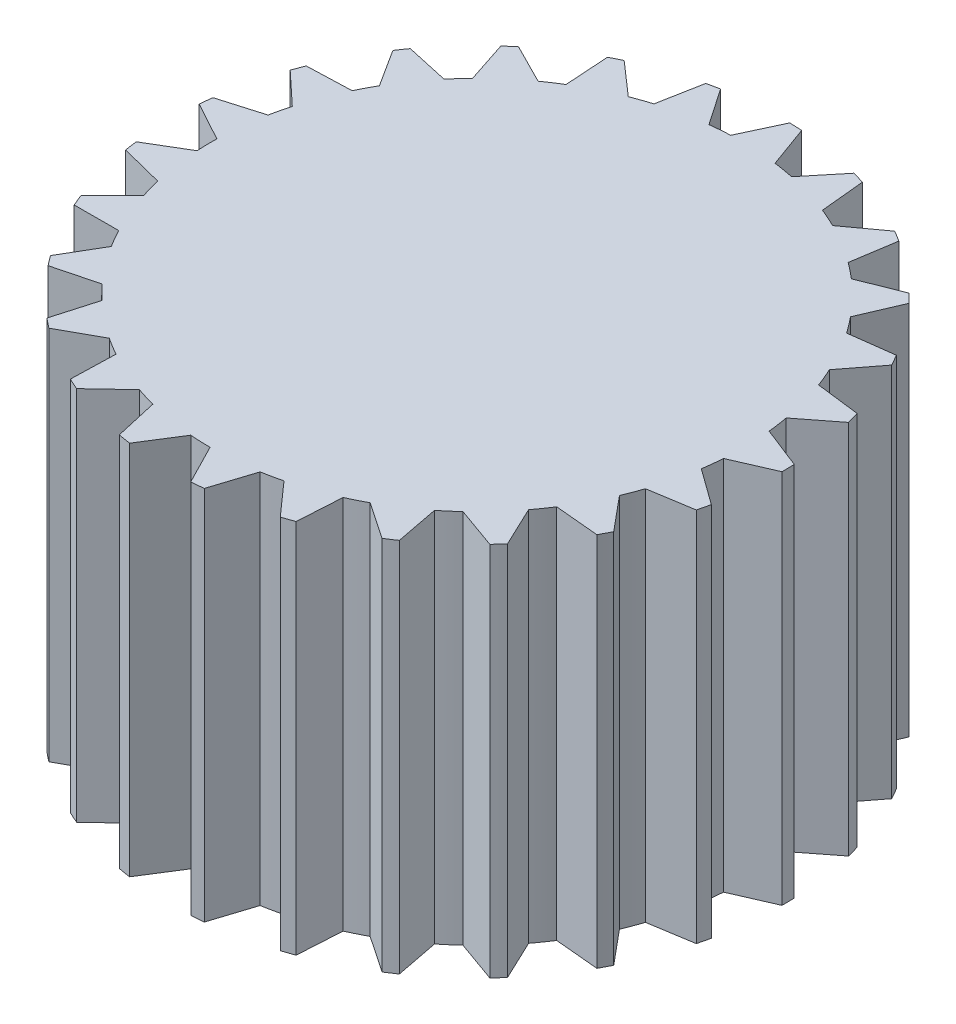
from build123d import *

# Parameters (mm, degrees)
SKETCH1_R           = 2.65
BOSS_EXTRUDE1_DEPTH = 3.75
CUT_EXTRUDE1_DEPTH  = 2.75
BOSS_EXTRUDE2_START = -3.75
BOSS_EXTRUDE2_DEPTH = 3.75


with BuildPart() as part:
    # Sketch1 → Boss-Extrude1 (new body)
    with BuildSketch(Plane(origin=(0, 0, 0), x_dir=(1, 0, 0), z_dir=(0, 1, 0))):
        with Locations(Location((0, 0, 0), (0, 0, 270))):
            Circle(SKETCH1_R)
    extrude(amount=BOSS_EXTRUDE1_DEPTH)

    # Sketch2 → Cut-Extrude1 (cut)
    with BuildSketch(Plane(origin=(0, 0, 0), x_dir=(-1, 0, 0), z_dir=(0, -1, 0))):
        Polygon((-0.749366211, 2.306312052), (-0.348066685, 2.197606558), (0, 2.425), (0.348066685, 2.197606558), (0.749366211, 2.306312052), (1.010128862, 1.982489516), (1.425379237, 1.961866211), (1.573312588, 1.573312588), (1.961866211, 1.425379237), (1.982489516, 1.010128862), (2.306312052, 0.749366211), (2.197606558, 0.348066685), (2.425, 0), (2.197606558, -0.348066685), (2.306312052, -0.749366211), (1.982489516, -1.010128862), (1.961866211, -1.425379237), (1.573312588, -1.573312588), (1.425379237, -1.961866211), (1.010128862, -1.982489516), (0.749366211, -2.306312052), (0.348066685, -2.197606558), (0, -2.425), (-0.348066685, -2.197606558), (-0.749366211, -2.306312052), (-1.010128862, -1.982489516), (-1.425379237, -1.961866211), (-1.573312588, -1.573312588), (-1.961866211, -1.425379237), (-1.982489516, -1.010128862), (-2.306312052, -0.749366211), (-2.197606558, -0.348066685), (-2.425, 0), (-2.197606558, 0.348066685), (-2.306312052, 0.749366211), (-1.982489516, 1.010128862), (-1.961866211, 1.425379237), (-1.573312588, 1.573312588), (-1.425379237, 1.961866211), (-1.010128862, 1.982489516), align=None)
    extrude(amount=-CUT_EXTRUDE1_DEPTH, mode=Mode.SUBTRACT)

    # Sketch3 → Boss-Extrude2 (add)
    with BuildSketch(Plane(origin=(0, 3.75, 0), x_dir=(1, 0, 0), z_dir=(0, 1, 0)).offset(BOSS_EXTRUDE2_START)):
        with BuildLine():
            Line((-2.649502742, 0.051334382), (-3.038574166, 0.26375564))
            ThreePointArc((-3.038574166, 0.26375564), (-3.03254237, 0.325863125), (-3.02524125, 0.387834215))
            Line((-3.02524125, 0.387834215), (-2.599921696, 0.512744745))
            ThreePointArc((-2.599921696, 0.512744745), (-2.578570239, 0.611126438), (-2.5534974, 0.708626156))
            Line((-2.5534974, 0.708626156), (-2.877518411, 1.011131938))
            ThreePointArc((-2.877518411, 1.011131938), (-2.856230611, 1.069788155), (-2.833747286, 1.127996595))
            Line((-2.833747286, 1.127996595), (-2.390725942, 1.143210159))
            ThreePointArc((-2.390725942, 1.143210159), (-2.345578748, 1.233191119), (-2.297046425, 1.321392342))
            Line((-2.297046425, 1.321392342), (-2.535657591, 1.694975097))
            ThreePointArc((-2.535657591, 1.694975097), (-2.500451378, 1.746494462), (-2.464198558, 1.7972828))
            Line((-2.464198558, 1.7972828), (-2.031312085, 1.701843475))
            ThreePointArc((-2.031312085, 1.701843475), (-1.965205918, 1.777769866), (-1.896263575, 1.851130588))
            Line((-1.896263575, 1.851130588), (-2.034472079, 2.272316738))
            ThreePointArc((-2.034472079, 2.272316738), (-1.98755959, 2.313462098), (-1.939815172, 2.353639118))
            Line((-1.939815172, 2.353639118), (-1.544263419, 2.153543706))
            ThreePointArc((-1.544263419, 2.153543706), (-1.461351973, 2.210644795), (-1.376331511, 2.264555491))
            Line((-1.376331511, 2.264555491), (-1.405453205, 2.706880361))
            ThreePointArc((-1.405453205, 2.706880361), (-1.349782122, 2.735066402), (-1.293546065, 2.762107633))
            Line((-1.293546065, 2.762107633), (-0.960183003, 2.469928866))
            ThreePointArc((-0.960183003, 2.469928866), (-0.865675909, 2.504616781), (-0.769919476, 2.535690044))
            Line((-0.769919476, 2.535690044), (-0.688124536, 2.971360736))
            ThreePointArc((-0.688124536, 2.971360736), (-0.62719288, 2.984816425), (-0.565998701, 2.997022768))
            Line((-0.565998701, 2.997022768), (-0.315770757, 2.631119311))
            ThreePointArc((-0.315770757, 2.631119311), (-0.215606244, 2.641214483), (-0.115130569, 2.647497866))
            Line((-0.115130569, 2.647497866), (0.072441528, 3.049139588))
            ThreePointArc((0.072441528, 3.049139588), (0.134805198, 3.047019455), (0.197112443, 3.043623939))
            Line((0.197112443, 3.043623939), (0.348482526, 2.626986854))
            ThreePointArc((0.348482526, 2.626986854), (0.448010755, 2.611854966), (0.546892416, 2.592953661))
            Line((0.546892416, 2.592953661), (0.828455824, 2.935329785))
            ThreePointArc((0.828455824, 2.935329785), (0.888332969, 2.917767046), (0.947838287, 2.898983025))
            Line((0.947838287, 2.898983025), (0.990839371, 2.457791151))
            ThreePointArc((0.990839371, 2.457791151), (1.08347759, 2.418382995), (1.174552138, 2.37548464))
            Line((1.174552138, 2.37548464), (1.532415194, 2.637082417))
            ThreePointArc((1.532415194, 2.637082417), (1.586043513, 2.605180603), (1.639007966, 2.572188346))
            Line((1.639007966, 2.572188346), (1.570938134, 2.134163391))
            ThreePointArc((1.570938134, 2.134163391), (1.650865543, 2.072955127), (1.72841043, 2.008755183))
            Line((1.72841043, 2.008755183), (2.140087281, 2.173137462))
            ThreePointArc((2.140087281, 2.173137462), (2.184097109, 2.128901082), (2.227192746, 2.083773613))
            Line((2.227192746, 2.083773613), (2.052329077, 1.676438296))
            ThreePointArc((2.052329077, 1.676438296), (2.114523543, 1.597275864), (2.173666338, 1.515808251))
            Line((2.173666338, 1.515808251), (2.613289814, 1.572646288))
            ThreePointArc((2.613289814, 1.572646288), (2.644915852, 1.518854876), (2.675434815, 1.464427721))
            Line((2.675434815, 1.464427721), (2.404764636, 1.113376418))
            ThreePointArc((2.404764636, 1.113376418), (2.445318252, 1.021233884), (2.482342795, 0.927617511))
            Line((2.482342795, 0.927617511), (2.922289737, 0.873339964))
            ThreePointArc((2.922289737, 0.873339964), (2.939544805, 0.813373432), (2.955569475, 0.753066449))
            Line((2.955569475, 0.753066449), (2.606099988, 0.480357004))
            ThreePointArc((2.606099988, 0.480357004), (2.622464622, 0.381024024), (2.635044526, 0.281141151))
            Line((2.635044526, 0.281141151), (3.047671448, 0.119158478))
            ThreePointArc((3.047671448, 0.119158478), (3.049471346, 0.056784744), (3.049994836, -0.005612758))
            Line((3.049994836, -0.005612758), (2.643684494, -0.182845006))
            ThreePointArc((2.643684494, -0.182845006), (2.634831895, -0.283126977), (2.622176718, -0.383000341))
            Line((2.622176718, -0.383000341), (2.981556754, -0.642510173))
            ThreePointArc((2.981556754, -0.642510173), (2.967788388, -0.703371938), (2.952777803, -0.763939294))
            Line((2.952777803, -0.763939294), (2.51515658, -0.834558193))
            ThreePointArc((2.51515658, -0.834558193), (2.48164299, -0.929488069), (2.444547903, -1.023076513))
            Line((2.444547903, -1.023076513), (2.728099883, -1.363807547))
            ThreePointArc((2.728099883, -1.363807547), (2.699628371, -1.419333175), (2.670026882, -1.474264715))
            Line((2.670026882, -1.474264715), (2.228592128, -1.433833019))
            ThreePointArc((2.228592128, -1.433833019), (2.172523329, -1.517446008), (2.113319153, -1.598869025))
            Line((2.113319153, -1.598869025), (2.303226464, -1.999411878))
            ThreePointArc((2.303226464, -1.999411878), (2.261840774, -2.046112488), (2.219508352, -2.091956662))
            Line((2.219508352, -2.091956662), (1.801997037, -1.943014843))
            ThreePointArc((1.801997037, -1.943014843), (1.726896037, -2.010057232), (1.649302788, -2.074198716))
            Line((1.649302788, -2.074198716), (1.733632855, -2.509385806))
            ThreePointArc((1.733632855, -2.509385806), (1.681933403, -2.544327028), (1.629529949, -2.578203278))
            Line((1.629529949, -2.578203278), (1.262175844, -2.330109898))
            ThreePointArc((1.262175844, -2.330109898), (1.172761516, -2.376369169), (1.081654663, -2.419198873))
            Line((1.081654663, -2.419198873), (1.055108718, -2.861685796))
            ThreePointArc((1.055108718, -2.861685796), (0.996343971, -2.882672144), (0.937162187, -2.902451901))
            Line((0.937162187, -2.902451901), (0.643047502, -2.570795579))
            ThreePointArc((0.643047502, -2.570795579), (0.544938076, -2.593365091), (0.446042198, -2.612191868))
            Line((0.446042198, -2.612191868), (0.31028822, -3.034175542))
            ThreePointArc((0.31028822, -3.034175542), (0.248150583, -3.039888368), (0.185909078, -3.044328795))
            Line((0.185909078, -3.044328795), (-0.016485881, -2.649948719))
            ThreePointArc((-0.016485881, -2.649948719), (-0.117125827, -2.647410346), (-0.217596739, -2.641051241))
            Line((-0.217596739, -2.641051241), (-0.454028829, -3.01601688))
            ThreePointArc((-0.454028829, -3.01601688), (-0.515635019, -3.006097225), (-0.577025382, -2.994919316))
            Line((-0.577025382, -2.994919316), (-0.674983394, -2.562595836))
            ThreePointArc((-0.674983394, -2.562595836), (-0.771830284, -2.535109073), (-0.867563272, -2.503963652))
            Line((-0.867563272, -2.503963652), (-1.189817576, -2.808350786))
            ThreePointArc((-1.189817576, -2.808350786), (-1.247021377, -2.783421938), (-1.303703216, -2.757328041))
            Line((-1.303703216, -2.757328041), (-1.291069219, -2.314225631))
            ThreePointArc((-1.291069219, -2.314225631), (-1.378037806, -2.263517573), (-1.463017615, -2.209542817))
            Line((-1.463017615, -2.209542817), (-1.850845709, -2.424225683))
            ThreePointArc((-1.850845709, -2.424225683), (-1.900052795, -2.385854014), (-1.948464581, -2.346483705))
            Line((-1.948464581, -2.346483705), (-1.826032417, -1.920444119))
            ThreePointArc((-1.826032417, -1.920444119), (-1.897658144, -1.84970094), (-1.96654518, -1.776288281))
            Line((-1.96654518, -1.776288281), (-2.395578399, -1.887777565))
            ThreePointArc((-2.395578399, -1.887777565), (-2.433696908, -1.838374108), (-2.470796751, -1.788201167))
            Line((-2.470796751, -1.788201167), (-2.246259282, -1.40599404))
            ThreePointArc((-2.246259282, -1.40599404), (-2.298041642, -1.319660794), (-2.346507479, -1.231423019))
            Line((-2.346507479, -1.231423019), (-2.789788088, -1.23271344))
            ThreePointArc((-2.789788088, -1.23271344), (-2.814422894, -1.175382395), (-2.837879674, -1.117559374))
            Line((-2.837879674, -1.117559374), (-2.525345415, -0.803200184))
            ThreePointArc((-2.525345415, -0.803200184), (-2.554030732, -0.706701507), (-2.579030083, -0.60918292))
            Line((-2.579030083, -0.60918292), (-3.008705131, -0.500193395))
            ThreePointArc((-3.008705131, -0.500193395), (-3.018308338, -0.438537084), (-3.02664818, -0.376697215))
            Line((-3.02664818, -0.376697215), (-2.645754808, -0.149938307))
            ThreePointArc((-2.645754808, -0.149938307), (-2.649540678, -0.049337565), (-2.649502742, 0.051334382))
        make_face()
        Polygon((0.749366211, 2.306312052), (0.348066685, 2.197606558), (0, 2.425), (-0.348066685, 2.197606558), (-0.749366211, 2.306312052), (-1.010128862, 1.982489516), (-1.425379237, 1.961866211), (-1.573312588, 1.573312588), (-1.961866211, 1.425379237), (-1.982489516, 1.010128862), (-2.306312052, 0.749366211), (-2.197606558, 0.348066685), (-2.425, 0), (-2.197606558, -0.348066685), (-2.306312052, -0.749366211), (-1.982489516, -1.010128862), (-1.961866211, -1.425379237), (-1.573312588, -1.573312588), (-1.425379237, -1.961866211), (-1.010128862, -1.982489516), (-0.749366211, -2.306312052), (-0.348066685, -2.197606558), (0, -2.425), (0.348066685, -2.197606558), (0.749366211, -2.306312052), (1.010128862, -1.982489516), (1.425379237, -1.961866211), (1.573312588, -1.573312588), (1.961866211, -1.425379237), (1.982489516, -1.010128862), (2.306312052, -0.749366211), (2.197606558, -0.348066685), (2.425, 0), (2.197606558, 0.348066685), (2.306312052, 0.749366211), (1.982489516, 1.010128862), (1.961866211, 1.425379237), (1.573312588, 1.573312588), (1.425379237, 1.961866211), (1.010128862, 1.982489516), align=None, mode=Mode.SUBTRACT)
    extrude(amount=BOSS_EXTRUDE2_DEPTH)


solid = part.part
